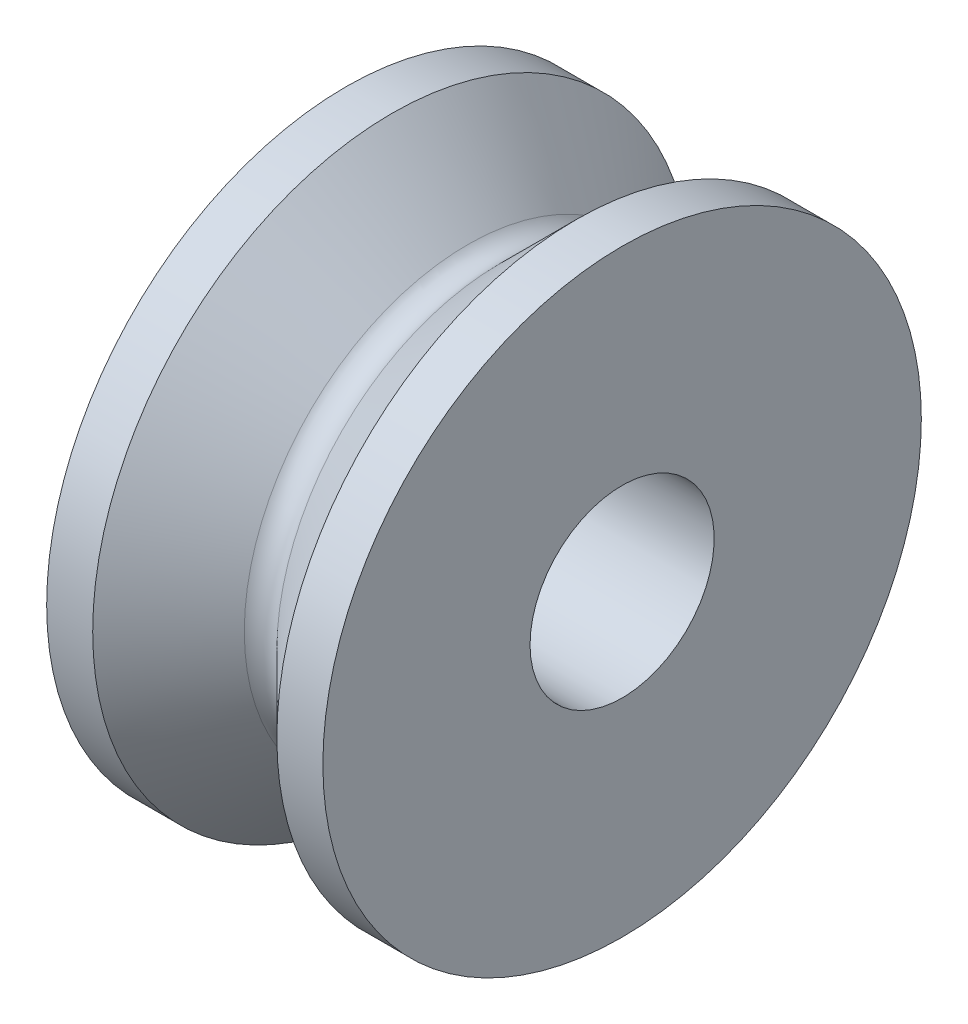
from build123d import *

# Parameters (mm, degrees)
FILLET_1_R = 0.5


with BuildPart() as part:
    # 草图1 → 旋转1 (revolve)
    with BuildSketch(Plane.XY, mode=Mode.PRIVATE) as revolve_1_sk:
        Polygon((0, 2), (-3, 2), (-3, 6.5), (-2, 6.5), (0, 4.5), align=None)
    revolve_1 = revolve(revolve_1_sk.sketch.rotate(Axis((-66.431667693, 0, 0), (1, 0, 0)), 90), axis=Axis((-66.431667693, 0, 0), (1, 0, 0)))

    # 镜向1: 旋转1 across plane
    add(revolve_1.mirror(Plane(origin=(0, 0, 0), x_dir=(0, 0, 1), z_dir=(1, 0, 0))))

    # 圆角1
    fillet_1_edges = [part.edges().sort_by_distance(p)[0] for p in [
        (0, 0, -4.5),
    ]]
    fillet(fillet_1_edges, radius=FILLET_1_R)


solid = part.part
